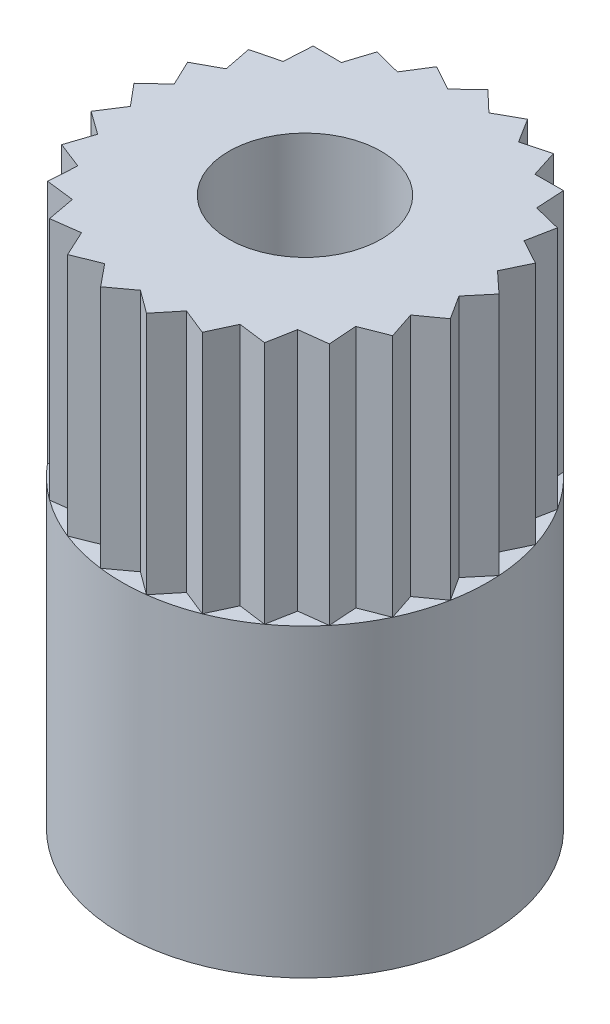
from build123d import *

# Parameters (mm, degrees)
EXTRUDE_1_DEPTH      = 5
EXTRUDE_1_DEPTH_BACK = 4
SKETCH_1_R           = 3
SKETCH_2_OUTSIDE_W   = 10.474
SKETCH_2_OUTSIDE_H   = 10.474
CUT_EXTRUDE_1_DEPTH  = 4
SKETCH_3_R           = 1.25
CUT_EXTRUDE_2_DEPTH  = 7


with BuildPart() as part:
    # Эскиз1 → Бобышка-Вытянуть1 (new, two sides: drawn at the far end of the back side and taken through both)
    with BuildSketch(Plane(origin=(0, 0, 0), x_dir=(1, 0, 0), z_dir=(0, 1, 0)).offset(-EXTRUDE_1_DEPTH_BACK)):
        with Locations(Location((0, 0, 0), (0, 0, 270))):
            Circle(SKETCH_1_R)
    extrude(amount=EXTRUDE_1_DEPTH + EXTRUDE_1_DEPTH_BACK)

    # Эскиз2 outside → Вырез-Вытянуть1 (cut)
    with BuildSketch(Plane(origin=(0, 5, 0), x_dir=(1, 0, 0), z_dir=(0, 1, 0))):
        Rectangle(SKETCH_2_OUTSIDE_W, SKETCH_2_OUTSIDE_H)
        Polygon((0, 3), (0.338399731, 2.678709694), (0.746069661, 2.905749483), (0.993936292, 2.510396512), (1.445261022, 2.62892004), (1.587020181, 2.184345885), (2.053641318, 2.186905882), (2.080385755, 1.721044772), (2.532983777, 1.607480385), (2.443033042, 1.149604087), (2.853169549, 0.927050983), (2.652175577, 0.505929549), (2.994080185, 0.188371559), (2.694672167, -0.169534403), (2.946861752, -0.562143944), (2.567852594, -0.834345885), (2.714481157, -1.277337875), (2.279685399, -1.446732346), (2.311539728, -1.912271969), (1.848277186, -1.968215294), (1.763355757, -2.427050983), (1.30073492, -2.366028036), (1.104373658, -2.789329458), (0.671462695, -2.615174535), (0.375999701, -2.976344104), (0, -2.7), (-0.375999701, -2.976344104), (-0.671462695, -2.615174535), (-1.104373658, -2.789329458), (-1.30073492, -2.366028036), (-1.763355757, -2.427050983), (-1.848277186, -1.968215294), (-2.311539728, -1.912271969), (-2.279685399, -1.446732346), (-2.714481157, -1.277337875), (-2.567852594, -0.834345885), (-2.946861752, -0.562143944), (-2.694672167, -0.169534403), (-2.994080185, 0.188371559), (-2.652175577, 0.505929549), (-2.853169549, 0.927050983), (-2.443033042, 1.149604087), (-2.532983777, 1.607480385), (-2.080385755, 1.721044772), (-2.053641318, 2.186905882), (-1.587020181, 2.184345885), (-1.445261022, 2.62892004), (-0.993936292, 2.510396512), (-0.746069661, 2.905749483), (-0.338399731, 2.678709694), align=None, mode=Mode.SUBTRACT)
    extrude(amount=-CUT_EXTRUDE_1_DEPTH, mode=Mode.SUBTRACT)

    # Эскиз3 → Вырез-Вытянуть2 (cut)
    with BuildSketch(Plane(origin=(0, 5, 0), x_dir=(1, 0, 0), z_dir=(0, 1, 0))):
        with Locations(Location((0, 0, 0), (0, 0, 270))):
            Circle(SKETCH_3_R)
    extrude(amount=-CUT_EXTRUDE_2_DEPTH, mode=Mode.SUBTRACT)


solid = part.part
